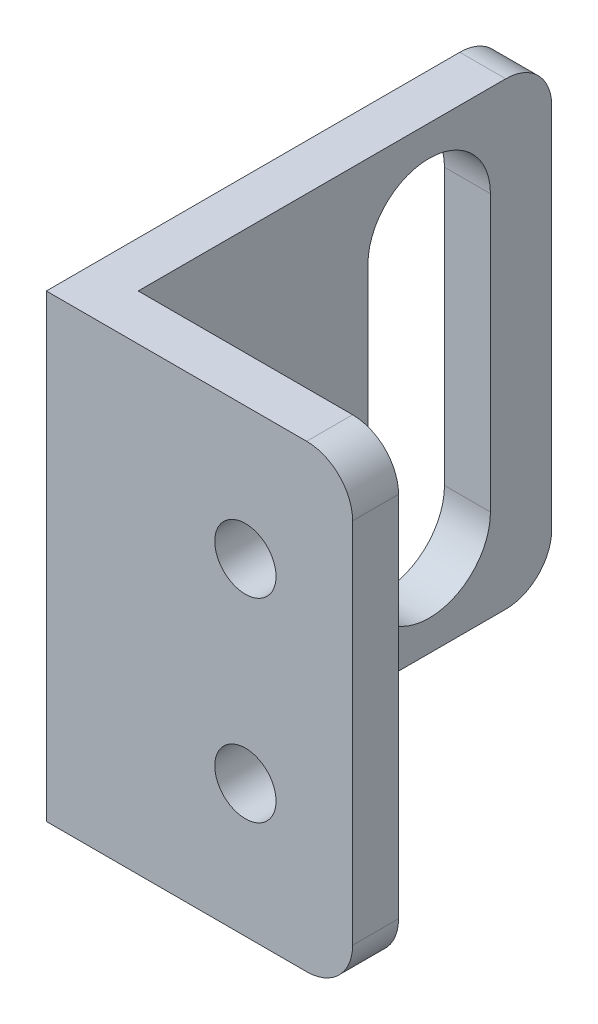
from build123d import *

# Parameters (mm, degrees)
SKETCH_1_W          = 3
SKETCH_1_H          = 27
SKETCH_1_H_2        = 3
SKETCH_1_W_2        = 17
EXTRUDE_1_DEPTH     = 30
SKETCH_2_R          = 2
CUT_EXTRUDE_1_DEPTH = 10
CUT_EXTRUDE_2_DEPTH = 10
FILLET_1_R          = 3


with BuildPart() as part:
    # 草图1 → 凸台-拉伸1 (new body)
    with BuildSketch(Plane(origin=(0, 0, 0), x_dir=(1, 0, 0), z_dir=(0, 1, 0))):
        with Locations((0, 1.5)):
            Rectangle(SKETCH_1_W, SKETCH_1_H)
        with Locations((0, -13.5)):
            Rectangle(SKETCH_1_W, SKETCH_1_H_2)
        with Locations((10, -13.5)):
            Rectangle(SKETCH_1_W_2, SKETCH_1_H_2)
    extrude(amount=EXTRUDE_1_DEPTH)

    # 草图2 → 切除-拉伸1 (cut)
    with BuildSketch(Plane.XY.offset(15)):
        with Locations((11.5, 21.35)):
            Circle(SKETCH_2_R)
        with Locations((11.5, 8.65)):
            Circle(SKETCH_2_R)
        with Locations((11.5, -4.05)):
            Circle(SKETCH_2_R)
    extrude(amount=-CUT_EXTRUDE_1_DEPTH, mode=Mode.SUBTRACT)

    # 草图3 → 切除-拉伸2 (cut)
    with BuildSketch(Plane.ZY.offset(1.5)):
        with BuildLine():
            Line((-3, 24), (-3, 6))
            ThreePointArc((-3, 6), (-7, 2), (-11, 6))
            Line((-11, 6), (-11, 24))
            ThreePointArc((-11, 24), (-7, 28), (-3, 24))
        make_face()
    extrude(amount=-CUT_EXTRUDE_2_DEPTH, mode=Mode.SUBTRACT)

    # 圆角1
    fillet_1_edges = [part.edges().sort_by_distance(p)[0] for p in [
        (18.5, 0, 13.5),
        (18.5, 30, 13.5),
        (0, 30, -15),
        (0, 0, -15),
    ]]
    fillet(fillet_1_edges, radius=FILLET_1_R)


solid = part.part
